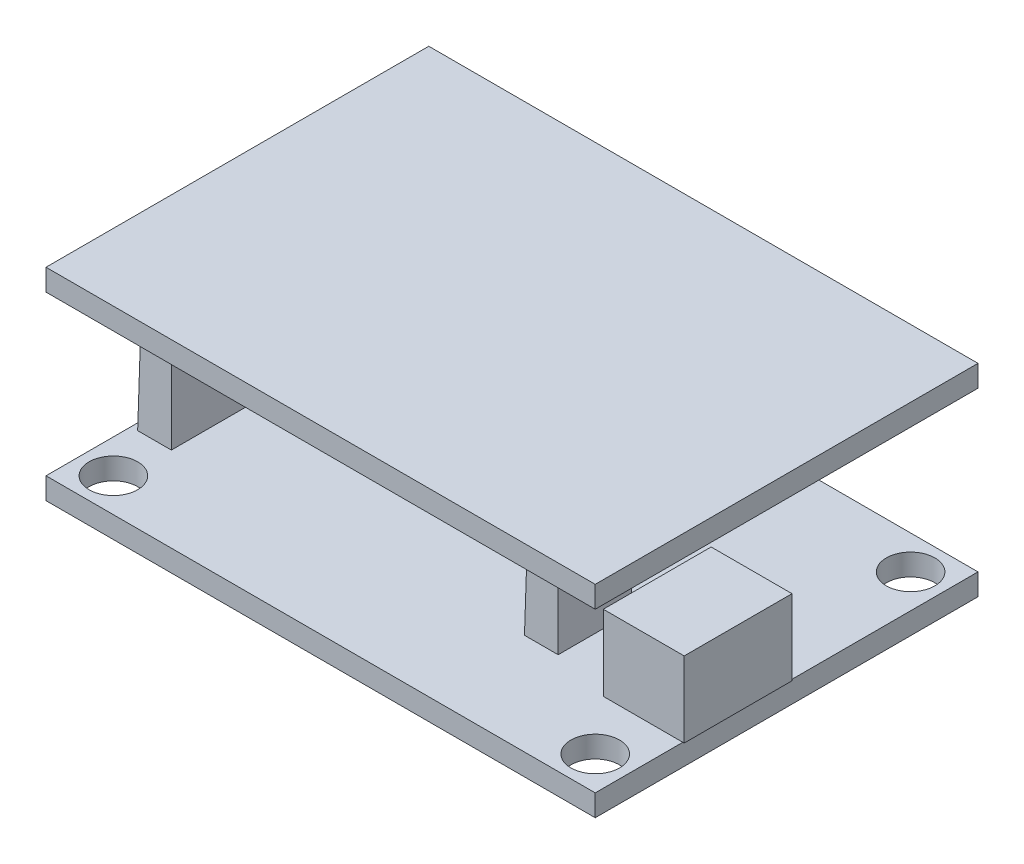
from build123d import *

# Parameters (mm, degrees)
ESQUISSE1_W                  = 40.75
ESQUISSE1_H                  = 28.4
BOSS_EXTRU_1_DEPTH           = 1.6
ESQUISSE2_R                  = 1.8
ENL_V_MAT_EXTRU_1_DEPTH      = 50.695900233
ESQUISSE3_W                  = 6
ESQUISSE3_H                  = 8
BOSS_EXTRU_2_DEPTH           = 5.6
ESQUISSE4_W                  = 2.5
ESQUISSE4_H                  = 15.2
BOSS_EXTRU_3_DEPTH           = 8.7
BOSS_EXTRU_3_DRAFT           = -1
ESQUISSE4_H_2                = 5.5
BOSS_EXTRU_3_PROFILE_2_DEPTH = 8.7
BOSS_EXTRU_3_PROFILE_2_DRAFT = -1
ESQUISSE5_W                  = 40.75
ESQUISSE5_H                  = 28.4
BOSS_EXTRU_4_DEPTH           = 1.6


with BuildPart() as part:
    # Esquisse1 → Boss.-Extru.1 (new body)
    with BuildSketch(Plane(origin=(0, 0, 0), x_dir=(1, 0, 0), z_dir=(0, 1, 0))):
        with Locations((20.375, 14.2)):
            Rectangle(ESQUISSE1_W, ESQUISSE1_H)
    extrude(amount=BOSS_EXTRU_1_DEPTH)

    # Esquisse2 → Enlèv. mat.-Extru.1 (cut, through all)
    with BuildSketch(Plane(origin=(0, 1.6, 0), x_dir=(1, 0, 0), z_dir=(0, 1, 0))):
        with Locations(Location((2.5, 25.9, 0), (0, 0, 270))):
            Circle(ESQUISSE2_R)
        with Locations(Location((38.25, 25.9, 0), (0, 0, 270))):
            Circle(ESQUISSE2_R)
        with Locations(Location((38.25, 2.5, 0), (0, 0, 270))):
            Circle(ESQUISSE2_R)
        with Locations(Location((2.5, 2.5, 0), (0, 0, 270))):
            Circle(ESQUISSE2_R)
    extrude(amount=-ENL_V_MAT_EXTRU_1_DEPTH, mode=Mode.SUBTRACT)

    # Esquisse3 → Boss.-Extru.2 (add)
    with BuildSketch(Plane(origin=(0, 1.6, 0), x_dir=(1, 0, 0), z_dir=(0, 1, 0))):
        with Locations((37.85, 10.5)):
            Rectangle(ESQUISSE3_W, ESQUISSE3_H)
    extrude(amount=BOSS_EXTRU_2_DEPTH)


with BuildPart() as boss_extru_3_tool:
    # Esquisse4 → Boss.-Extru.3 (with draft: the straight prism first)
    with BuildSketch(Plane.XZ.offset(-1.6)):
        with Locations((1.75, -13.9)):
            Rectangle(ESQUISSE4_W, ESQUISSE4_H)
    extrude(amount=-BOSS_EXTRU_3_DEPTH)
    # Boss.-Extru.3: the draft: its side faces are tilted about the plane it starts from
    boss_extru_3_sides = [boss_extru_3_tool.faces().sort_by_distance(p)[0] for p in [
        (0.5, 5.95, -13.9),
        (1.75, 5.95, -21.5),
        (3, 5.95, -13.9),
        (1.75, 5.95, -6.3),
    ]]
    draft(boss_extru_3_sides, Plane.XZ.offset(-1.6), BOSS_EXTRU_3_DRAFT)


with BuildPart() as part_1:
    add(part.part)

    # Boss.-Extru.3: add boss_extru_3_tool
    add(boss_extru_3_tool.part)


with BuildPart() as boss_extru_3_profile_2_tool:
    # Esquisse4 → Boss.-Extru.3 profile 2 (with draft: the straight prism first)
    with BuildSketch(Plane.XZ.offset(-1.6)):
        with Locations((29.25, -10.25)):
            Rectangle(ESQUISSE4_W, ESQUISSE4_H_2)
    extrude(amount=-BOSS_EXTRU_3_PROFILE_2_DEPTH)
    # Boss.-Extru.3 profile 2: the draft: its side faces are tilted about the plane it starts from
    boss_extru_3_profile_2_sides = [boss_extru_3_profile_2_tool.faces().sort_by_distance(p)[0] for p in [
        (28, 5.95, -10.25),
        (29.25, 5.95, -13),
        (30.5, 5.95, -10.25),
        (29.25, 5.95, -7.5),
    ]]
    draft(boss_extru_3_profile_2_sides, Plane.XZ.offset(-1.6), BOSS_EXTRU_3_PROFILE_2_DRAFT)


with BuildPart() as part_2:
    add(part_1.part)

    # Boss.-Extru.3 profile 2: add boss_extru_3_profile_2_tool
    add(boss_extru_3_profile_2_tool.part)


with BuildPart() as body_2:
    # Esquisse5 → Boss.-Extru.4 (new body)
    with BuildSketch(Plane.XZ.offset(-15)):
        with Locations((20.375, -14.2)):
            Rectangle(ESQUISSE5_W, ESQUISSE5_H)
    extrude(amount=BOSS_EXTRU_4_DEPTH)


solid = Compound([part_2.part, body_2.part])
